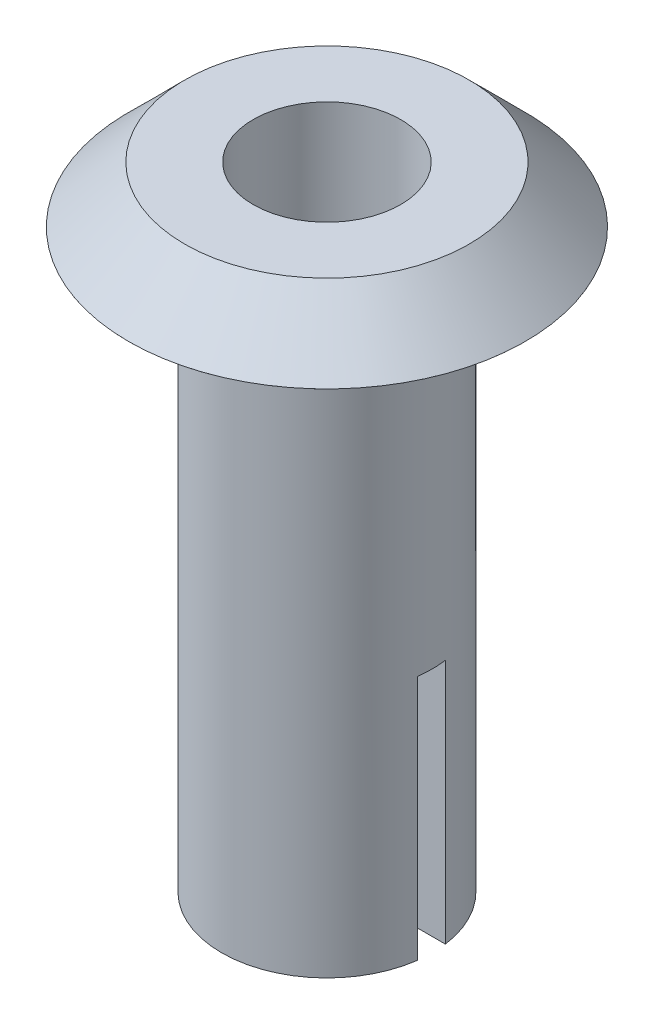
from build123d import *

# Parameters (mm, degrees)
CROQUIS1_R                   = 1.5
SALIENTE_EXTRUIR1_DEPTH      = 9
SALIENTE_EXTRUIR2_DEPTH      = 0.0001
SALIENTE_EXTRUIR2_DEPTH_BACK = 0.8
CROQUIS2_R                   = 2.825
CHAFL_N1_SIZE                = 0.8
CROQUIS3_R                   = 1.05
CORTAR_EXTRUIR1_DEPTH        = 7.5
REDONDEO2_R                  = 0.8
CROQUIS6_W                   = 3
CROQUIS6_H                   = 0.4
CORTAR_EXTRUIR4_DEPTH        = 3.5


with BuildPart() as part:
    # Croquis1 → Saliente-Extruir1 (new body)
    with BuildSketch(Plane(origin=(0, 0, 0), x_dir=(1, 0, 0), z_dir=(0, 1, 0))):
        with Locations(Location((0, 0, 0), (0, 0, 270))):
            Circle(CROQUIS1_R)
    extrude(amount=SALIENTE_EXTRUIR1_DEPTH)

    # Croquis2 → Saliente-Extruir2 (add, two sides: drawn at the far end of the back side and taken through both)
    with BuildSketch(Plane(origin=(0, 9, 0), x_dir=(1, 0, 0), z_dir=(0, 1, 0)).offset(-SALIENTE_EXTRUIR2_DEPTH_BACK)):
        with Locations(Location((0, 0, 0), (0, 0, 270))):
            Circle(CROQUIS2_R)
    extrude(amount=SALIENTE_EXTRUIR2_DEPTH + SALIENTE_EXTRUIR2_DEPTH_BACK)

    # Chaflán1
    chafl_n1_edges = [part.edges().sort_by_distance(p)[0] for p in [
        (0, 9.0001, -2.825),
    ]]
    chamfer(chafl_n1_edges, length=CHAFL_N1_SIZE)

    # Croquis3 → Cortar-Extruir1 (cut)
    with BuildSketch(Plane(origin=(0, 9.0001, 0), x_dir=(1, 0, 0), z_dir=(0, 1, 0))):
        with Locations(Location((0, 0, 0), (0, 0, 270))):
            Circle(CROQUIS3_R)
    extrude(amount=-CORTAR_EXTRUIR1_DEPTH, mode=Mode.SUBTRACT)

    # Redondeo2
    redondeo2_edges = [part.edges().sort_by_distance(p)[0] for p in [
        (0, 1.5001, -1.05),
    ]]
    fillet(redondeo2_edges, radius=REDONDEO2_R)

    # Croquis6 → Cortar-Extruir4 (cut)
    with BuildSketch(Plane(origin=(0, 0, 0), x_dir=(-1, 0, 0), z_dir=(0, -1, 0))):
        Rectangle(CROQUIS6_W, CROQUIS6_H)
    extrude(amount=-CORTAR_EXTRUIR4_DEPTH, mode=Mode.SUBTRACT)


solid = part.part
